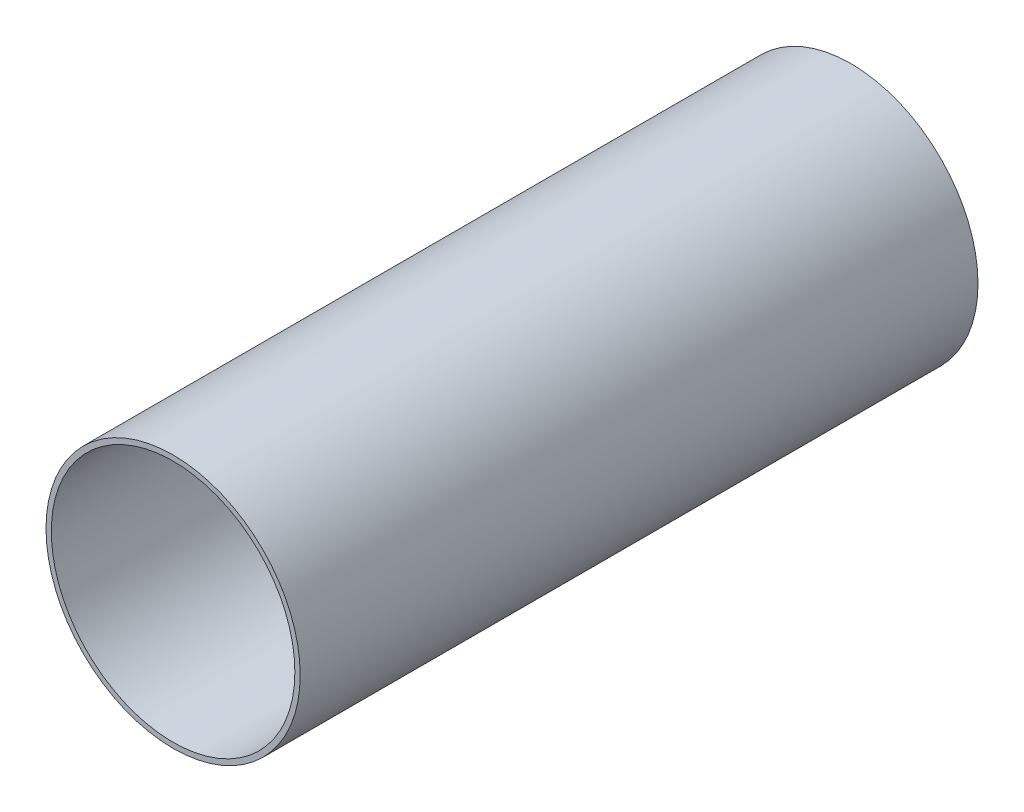
from build123d import *

# Parameters (mm, degrees)
SKETCH1_R           = 38.1
SKETCH1_R_2         = 36.5125
BOSS_EXTRUDE1_DEPTH = 203.2


with BuildPart() as part:
    # Sketch1 → Boss-Extrude1 (new body)
    with BuildSketch(Plane.XY):
        Circle(SKETCH1_R)
        Circle(SKETCH1_R_2, mode=Mode.SUBTRACT)
    extrude(amount=BOSS_EXTRUDE1_DEPTH)


solid = part.part
